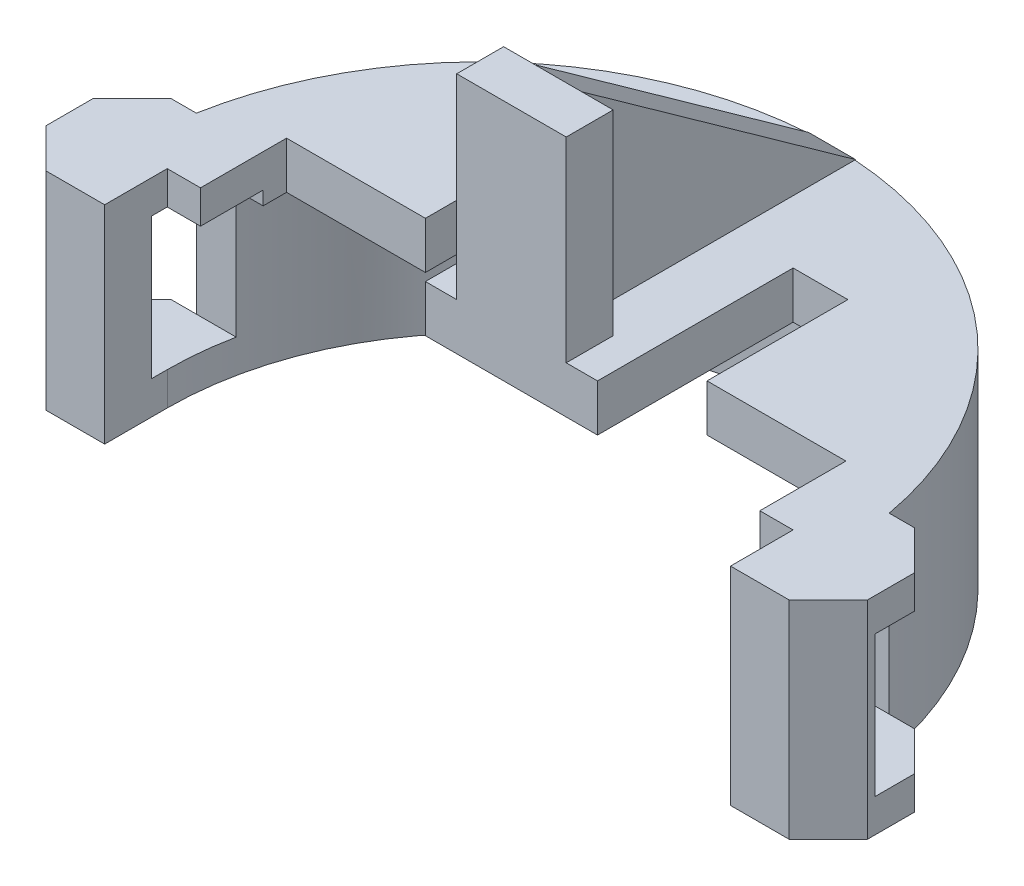
from build123d import *

# Parameters (mm, degrees)
SKETCH1_W           = 8
SKETCH1_H           = 1.2
SKETCH1_W_2         = 1
SKETCH1_H_2         = 4.1
REVOLVE1_ANGLE      = 180
SKETCH2_W           = 6.21
SKETCH2_H           = 1.5
CUT_EXTRUDE1_DEPTH  = 14.787313009
CUT_EXTRUDE2_DEPTH  = 14.787313009
SKETCH4_W           = 3.4
SKETCH4_H           = 2
BOSS_EXTRUDE1_DEPTH = 1.2
SKETCH6_W           = 2.8
SKETCH6_H           = 5
BOSS_EXTRUDE3_DEPTH = 1.2
BOSS_EXTRUDE4_DEPTH = 0.6
SKETCH8_W           = 4.65
SKETCH8_H           = 2.2
SKETCH8_W_2         = 16.704991512
SKETCH8_H_2         = 4.40240097
CUT_EXTRUDE3_DEPTH  = 10
SKETCH5_W           = 3.2
SKETCH5_H           = 5.3
BOSS_EXTRUDE5_DEPTH = 2.5
SKETCH9_W           = 2
SKETCH9_H           = 3.6
CUT_EXTRUDE4_DEPTH  = 5
CHAMFER1_SIZE       = 1


with BuildPart() as part:
    # Sketch1 → Revolve1 (revolve)
    with BuildSketch(Plane.XY):
        with Locations((4, 4.7)):
            Rectangle(SKETCH1_W, SKETCH1_H)
        with Locations((8.5, 4.7)):
            Rectangle(SKETCH1_W_2, SKETCH1_H)
        with Locations((8.5, 2.05)):
            Rectangle(SKETCH1_W_2, SKETCH1_H_2)
    revolve(axis=Axis((0, 0, 0), (0, 1, 0)), revolution_arc=REVOLVE1_ANGLE)

    # Sketch2 → Cut-Extrude1 (cut, through all)
    with BuildSketch(Plane.XY):
        with Locations((0, 3.35)):
            Rectangle(SKETCH2_W, SKETCH2_H)
    extrude(amount=-CUT_EXTRUDE1_DEPTH, mode=Mode.SUBTRACT)

    # Sketch3 → Cut-Extrude2 (cut, through all)
    with BuildSketch(Plane(origin=(0, 5.3, 0), x_dir=(1, 0, 0), z_dir=(0, 1, 0))):
        Polygon((-2.2, 5.8), (-3.6, 5.8), (-3.6, 0), (3.6, 0), (3.6, 5.8), (2.2, 5.8), (2.2, 0.8), (-2.2, 0.8), align=None)
    extrude(amount=-CUT_EXTRUDE2_DEPTH, mode=Mode.SUBTRACT)

    # Sketch4 → Boss-Extrude1 (add)
    with BuildSketch(Plane(origin=(0, 5.3, 0), x_dir=(1, 0, 0), z_dir=(0, 1, 0))):
        with Locations((5.3, -1)):
            Rectangle(SKETCH4_W, SKETCH4_H)
        with Locations((-5.3, -1)):
            Rectangle(SKETCH4_W, SKETCH4_H)
    extrude(amount=-BOSS_EXTRUDE1_DEPTH)

    # Sketch6 → Boss-Extrude3 (add)
    with BuildSketch(Plane.XY.offset(-0.8)):
        with Locations((0, 7.8)):
            Rectangle(SKETCH6_W, SKETCH6_H)
    extrude(amount=-BOSS_EXTRUDE3_DEPTH)

    # Sketch7 → Boss-Extrude4 (add, symmetric)
    with BuildSketch(Plane(origin=(0, 0, 0), x_dir=(0, 0, -1), z_dir=(1, 0, 0))):
        Polygon((2, 10.3), (9, 5.3), (2, 5.3), align=None)
    extrude(amount=BOSS_EXTRUDE4_DEPTH, both=True)

    # Sketch8 → Cut-Extrude3 (cut)
    with BuildSketch(Plane(origin=(0, 5.3, 0), x_dir=(1, 0, 0), z_dir=(0, 1, 0))):
        Polygon((-3.6, 0), (-3.6, 2.2), (-7.15, 2.2), (-7.15, 0), (-7, 0), align=None)
        with Locations((4.825, 1.1)):
            Rectangle(SKETCH8_W, SKETCH8_H)
        with Locations((1.202495756, -2.201200485)):
            Rectangle(SKETCH8_W_2, SKETCH8_H_2)
    extrude(amount=-CUT_EXTRUDE3_DEPTH, mode=Mode.SUBTRACT)

    # Sketch5 → Boss-Extrude5 (add)
    with BuildSketch(Plane(origin=(8, 0, 0), x_dir=(0, 0, -1), z_dir=(1, 0, 0))):
        with Locations((0, 2.65)):
            Rectangle(SKETCH5_W, SKETCH5_H)
    boss_extrude5 = extrude(amount=BOSS_EXTRUDE5_DEPTH)

    # Sketch9 → Cut-Extrude4 (cut)
    with BuildSketch(Plane(origin=(10.5, 0, 0), x_dir=(0, 0, -1), z_dir=(1, 0, 0))):
        with Locations((0.6, 2.65)):
            Rectangle(SKETCH9_W, SKETCH9_H)
    cut_extrude4 = extrude(amount=-CUT_EXTRUDE4_DEPTH, mode=Mode.SUBTRACT)

    # Mirror1: Boss-Extrude5, Cut-Extrude4 across plane
    add(boss_extrude5.mirror(Plane(origin=(0, 0, 0), x_dir=(0, 0, 1), z_dir=(1, 0, 0))))
    add(cut_extrude4.mirror(Plane(origin=(0, 0, 0), x_dir=(0, 0, 1), z_dir=(1, 0, 0))), mode=Mode.SUBTRACT)

    # Chamfer1
    chamfer1_edges = [part.edges().sort_by_distance(p)[0] for p in [
        (10.5, 4.875, -1.6),
        (10.5, 2.65, 1.6),
        (10.5, 0.425, -1.6),
        (-10.5, 2.65, 1.6),
        (-10.5, 4.875, -1.6),
        (-10.5, 0.425, -1.6),
    ]]
    chamfer(chamfer1_edges, length=CHAMFER1_SIZE)


solid = part.part
